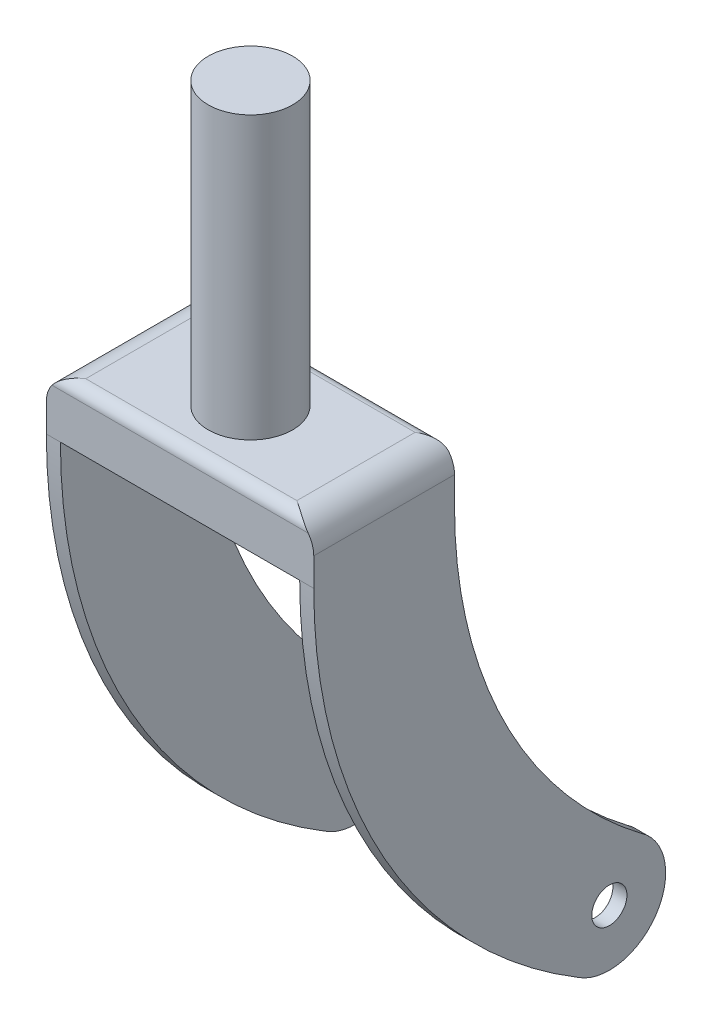
from build123d import *
from OCP.BRepFilletAPI import BRepFilletAPI_MakeFillet

# Parameters (mm, degrees)
BOSS_EXTRUDE1_DEPTH      = 30.1625
BOSS_EXTRUDE1_DEPTH_BACK = 30.1625
SKETCH1_R                = 3.96875
SKETCH2_W                = 53.975
SKETCH2_H                = 127
CUT_EXTRUDE1_DEPTH       = 138.343982508
SKETCH3_R                = 9.525
BOSS_EXTRUDE2_DEPTH      = 63.5
FILLET5_R1               = 6.35
FILLET5_R2               = 2.54


with BuildPart() as part:
    # Sketch1 → Boss-Extrude1 (new, two sides: drawn at the far end of the back side and taken through both)
    with BuildSketch(Plane(origin=(0, 0, 0), x_dir=(0, 0, -1), z_dir=(1, 0, 0)).offset(-BOSS_EXTRUDE1_DEPTH_BACK)):
        with BuildLine():
            Line((-66.675, 107.95), (-34.925, 107.95))
            Line((-34.925, 107.95), (-34.925, 95.25))
            ThreePointArc((-34.925, 95.25), (-23.848499799, 47.977772084), (7.075086505, 10.546712803))
            ThreePointArc((7.075086505, 10.546712803), (10.546712803, -7.075086505), (-7.075086505, -10.546712803))
            ThreePointArc((-7.075086505, -10.546712803), (-50.749935163, 34.535310409), (-66.675, 95.25))
            Line((-66.675, 95.25), (-66.675, 107.95))
        make_face()
        Circle(SKETCH1_R, mode=Mode.SUBTRACT)
    extrude(amount=BOSS_EXTRUDE1_DEPTH + BOSS_EXTRUDE1_DEPTH_BACK)

    # Sketch2 → Cut-Extrude1 (cut, through all)
    with BuildSketch(Plane.XY.offset(66.675)):
        with Locations((0, 31.75)):
            Rectangle(SKETCH2_W, SKETCH2_H)
    extrude(amount=-CUT_EXTRUDE1_DEPTH, mode=Mode.SUBTRACT)

    # Sketch3 → Boss-Extrude2 (add)
    with BuildSketch(Plane(origin=(0, 107.95, 0), x_dir=(1, 0, 0), z_dir=(0, 1, 0))):
        with Locations((0, -50.8)):
            Circle(SKETCH3_R)
    extrude(amount=BOSS_EXTRUDE2_DEPTH)

    # Fillet5: one fillet with a radius per group of edges: ONE call of the kernel's fillet builder (fillet() takes one radius for all edges)
    fillet5_edges_1 = [part.edges().sort_by_distance(p)[0] for p in [
        (-30.1625, 107.95, 50.8),
        (30.1625, 107.95, 50.8),
    ]]
    fillet5_edges_2 = [part.edges().sort_by_distance(p)[0] for p in [
        (0, 107.95, 34.925),
        (0, 107.95, 66.675),
    ]]
    fillet5 = BRepFilletAPI_MakeFillet(part.part.solid().wrapped)
    for e in fillet5_edges_1:
        fillet5.Add(FILLET5_R1, e.wrapped)
    for e in fillet5_edges_2:
        fillet5.Add(FILLET5_R2, e.wrapped)
    add(Compound.cast(fillet5.Shape()), mode=Mode.REPLACE)


solid = part.part
